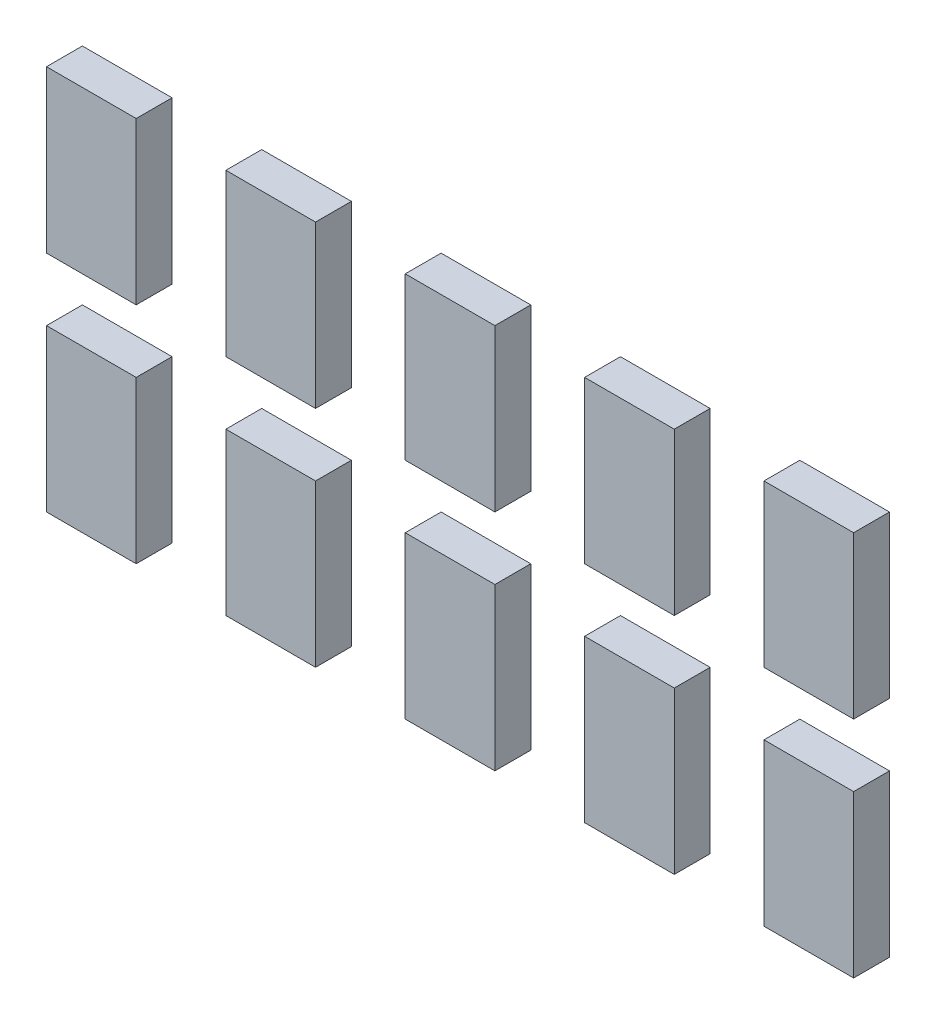
from build123d import *

# Parameters (mm, degrees)
SKETCH_1_W         = 2
SKETCH_1_H         = 3.6
EXTRUDE_1_DEPTH    = 0.8
EXTRUDE_1_2_DEPTH  = 0.8
EXTRUDE_1_3_DEPTH  = 0.8
EXTRUDE_1_4_DEPTH  = 0.8
EXTRUDE_1_5_DEPTH  = 0.8
EXTRUDE_1_6_DEPTH  = 0.8
EXTRUDE_1_7_DEPTH  = 0.8
EXTRUDE_1_8_DEPTH  = 0.8
EXTRUDE_1_9_DEPTH  = 0.8
EXTRUDE_1_10_DEPTH = 0.8


with BuildPart() as part:
    # Эскиз1 → Бобышка-Вытянуть1 (new body)
    with BuildSketch(Plane.XY):
        with Locations((4, 0)):
            Rectangle(SKETCH_1_W, SKETCH_1_H)
    extrude(amount=EXTRUDE_1_DEPTH)


with BuildPart() as body_2:
    # Эскиз1 → Extrude 1 2 (new body)
    with BuildSketch(Plane.XY):
        Rectangle(SKETCH_1_W, SKETCH_1_H)
    extrude(amount=EXTRUDE_1_2_DEPTH)


with BuildPart() as body_3:
    # Эскиз1 → Extrude 1 3 (new body)
    with BuildSketch(Plane.XY):
        with Locations((8, 0)):
            Rectangle(SKETCH_1_W, SKETCH_1_H)
    extrude(amount=EXTRUDE_1_3_DEPTH)


with BuildPart() as body_4:
    # Эскиз1 → Extrude 1 4 (new body)
    with BuildSketch(Plane.XY):
        with Locations((12, 0)):
            Rectangle(SKETCH_1_W, SKETCH_1_H)
    extrude(amount=EXTRUDE_1_4_DEPTH)


with BuildPart() as body_5:
    # Эскиз1 → Extrude 1 5 (new body)
    with BuildSketch(Plane.XY):
        with Locations((16, 0)):
            Rectangle(SKETCH_1_W, SKETCH_1_H)
    extrude(amount=EXTRUDE_1_5_DEPTH)


with BuildPart() as body_6:
    # Эскиз1 → Extrude 1 6 (new body)
    with BuildSketch(Plane.XY):
        with Locations((4, 5)):
            Rectangle(SKETCH_1_W, SKETCH_1_H)
    extrude(amount=EXTRUDE_1_6_DEPTH)


with BuildPart() as body_7:
    # Эскиз1 → Extrude 1 7 (new body)
    with BuildSketch(Plane.XY):
        with Locations((8, 5)):
            Rectangle(SKETCH_1_W, SKETCH_1_H)
    extrude(amount=EXTRUDE_1_7_DEPTH)


with BuildPart() as body_8:
    # Эскиз1 → Extrude 1 8 (new body)
    with BuildSketch(Plane.XY):
        with Locations((12, 5)):
            Rectangle(SKETCH_1_W, SKETCH_1_H)
    extrude(amount=EXTRUDE_1_8_DEPTH)


with BuildPart() as body_9:
    # Эскиз1 → Extrude 1 9 (new body)
    with BuildSketch(Plane.XY):
        with Locations((16, 5)):
            Rectangle(SKETCH_1_W, SKETCH_1_H)
    extrude(amount=EXTRUDE_1_9_DEPTH)


with BuildPart() as body_10:
    # Эскиз1 → Extrude 1 10 (new body)
    with BuildSketch(Plane.XY):
        with Locations((0, 5)):
            Rectangle(SKETCH_1_W, SKETCH_1_H)
    extrude(amount=EXTRUDE_1_10_DEPTH)


solid = Compound([part.part, body_2.part, body_3.part, body_4.part, body_5.part, body_6.part, body_7.part, body_8.part, body_9.part, body_10.part])
